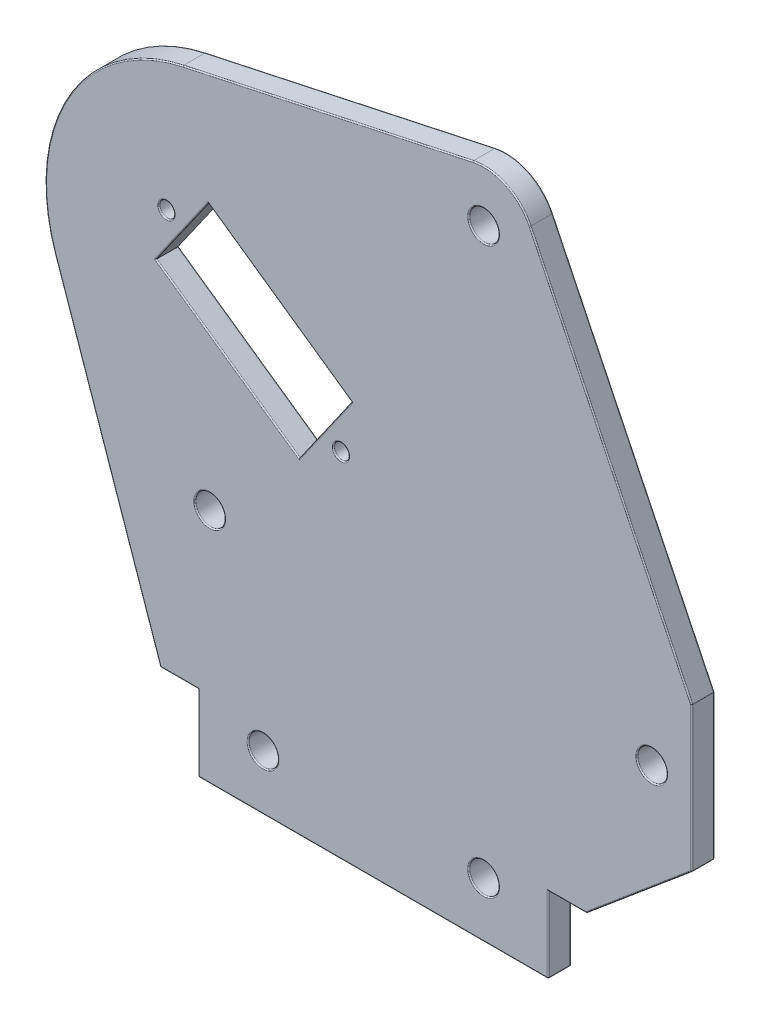
from build123d import *

# Parameters (mm, degrees)
SKETCH1_R                  = 1
BOSS_EXTRUDE1_DEPTH        = 3
M3_5_CLEARANCE_HOLE1_D     = 3.9
M3_5_CLEARANCE_HOLE1_DEPTH = 3
M3_5_CLEARANCE_HOLE1_TIP   = 1.171678207
FILLET1_R                  = 0.15


with BuildPart() as part:
    # Sketch1 → Boss-Extrude1 (new body)
    with BuildSketch(Plane.XY):
        with BuildLine():
            Line((-23, 0), (23, 0))
            Line((23, 0), (23, 10))
            Line((23, 10), (28, 10))
            Line((28, 10), (41.85, 21.621529892))
            Line((41.85, 21.621529892), (41.85, 40.621529892))
            Line((41.85, 40.621529892), (20.610605748, 84.460506273))
            ThreePointArc((20.610605748, 84.460506273), (17.477220077, 87.602479874), (13.072325527, 88.138211024))
            Line((13.072325527, 88.138211024), (-25.029728066, 79.943634341))
            ThreePointArc((-25.029728066, 79.943634341), (-40.146654928, 68.813612437), (-41.843761624, 50.118193368))
            Line((-41.843761624, 50.118193368), (-28, 10))
            Line((-28, 10), (-23, 10))
            Line((-23, 10), (-23, 0))
        make_face()
        with Locations((-27.182792376, 62.455399709)):
            Circle(SKETCH1_R, mode=Mode.SUBTRACT)
        with Locations(Location((-4.246535136, 46.395259491, 0), (0, 0, 180))):
            Circle(SKETCH1_R, mode=Mode.SUBTRACT)
        Polygon((-28.576370884, 56.106546352), (-21.693453648, 65.936370884), (-2.852956629, 52.744112848), (-9.735873865, 42.914288316), align=None, mode=Mode.SUBTRACT)
    extrude(amount=BOSS_EXTRUDE1_DEPTH)

    # M3.5 Clearance Hole1
    with Locations(Plane.XY.offset(3)):
        with Locations((14.5, 81.5), (-21.5, 31.121529892), (-14.5, 7.25), (14.5, 7.25), (36.6, 31.121529892)):
            Hole(M3_5_CLEARANCE_HOLE1_D / 2, depth=M3_5_CLEARANCE_HOLE1_DEPTH)
            with Locations((0, 0, -(M3_5_CLEARANCE_HOLE1_DEPTH + M3_5_CLEARANCE_HOLE1_TIP / 2))):  # 118° drill point
                Cone(0, M3_5_CLEARANCE_HOLE1_D / 2, M3_5_CLEARANCE_HOLE1_TIP, mode=Mode.SUBTRACT)

    # Fillet1
    fillet1_edges = [part.edges().sort_by_distance(p)[0] for p in [
        (23, 5, 3),
        (-25.5, 10, 0),
        (-34.921880812, 30.059096684, 0),
        (-40.146654928, 68.813612437, 0),
        (-5.978701269, 84.040922682, 0),
        (17.477220077, 87.602479874, 0),
        (31.230302874, 62.541018083, 0),
        (25.5, 10, 3),
        (41.85, 31.121529892, 0),
        (34.925, 15.810764946, 0),
        (25.5, 10, 0),
        (23, 5, 0),
        (0, 0, 0),
        (-23, 5, 0),
        (34.925, 15.810764946, 3),
        (41.85, 31.121529892, 3),
        (-28, 10, 1.5),
        (41.85, 40.621529892, 1.5),
        (41.85, 21.621529892, 1.5),
        (28, 10, 1.5),
        (23, 0, 1.5),
        (-23, 0, 1.5),
        (31.230302874, 62.541018083, 3),
        (17.477220077, 87.602479874, 3),
        (-5.978701269, 84.040922682, 3),
        (-40.146654928, 68.813612437, 3),
        (-19.156122375, 49.510417334, 0),
        (-6.294415247, 47.829200582, 0),
        (-12.273205138, 59.340241866, 0),
        (-25.134912266, 61.021458618, 0),
        (-34.921880812, 30.059096684, 3),
        (-19.156122375, 49.510417334, 3),
        (-6.294415247, 47.829200582, 3),
        (-12.273205138, 59.340241866, 3),
        (-25.134912266, 61.021458618, 3),
        (-25.5, 10, 3),
        (-23, 5, 3),
        (-28.182792376, 62.455399709, 0),
        (-28.182792376, 62.455399709, 3),
        (-3.246535136, 46.395259491, 0),
        (-3.246535136, 46.395259491, 3),
        (38.55, 31.121529892, 3),
        (38.55, 31.121529892, 0),
        (16.45, 7.25, 3),
        (16.45, 7.25, 0),
        (-12.55, 7.25, 3),
        (-12.55, 7.25, 0),
        (0, 0, 3),
        (-19.55, 31.121529892, 3),
        (-19.55, 31.121529892, 0),
        (16.45, 81.5, 3),
        (16.45, 81.5, 0),
    ]]
    fillet(fillet1_edges, radius=FILLET1_R)


solid = part.part
